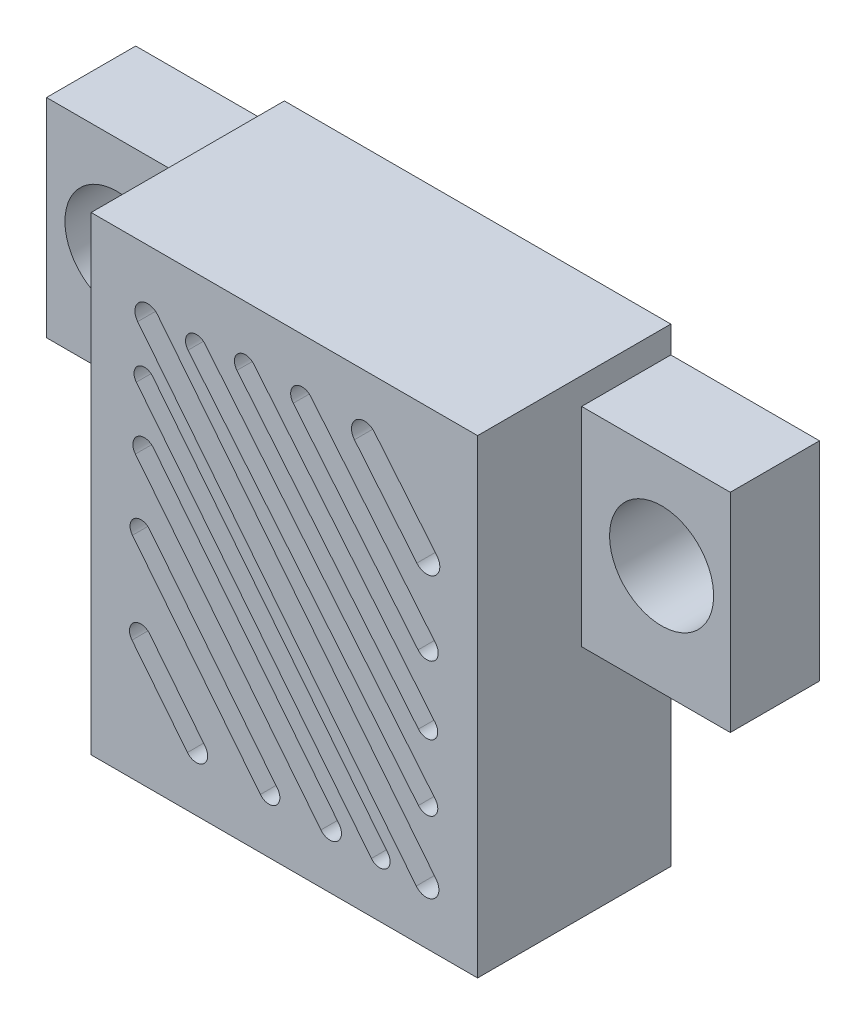
from build123d import *

# Parameters (mm, degrees)
SKETCH1_W           = 13
SKETCH1_H           = 15.8
BOSS_EXTRUDE1_DEPTH = 6.5
SHELL1_T            = -1
CUT_EXTRUDE2_DEPTH  = 2.5
SKETCH3_W           = 5
SKETCH3_H           = 7
BOSS_EXTRUDE2_DEPTH = 3
SKETCH4_R           = 1.75
CUT_EXTRUDE3_DEPTH  = 5


with BuildPart() as part:
    # Sketch1 → Boss-Extrude1 (new body)
    with BuildSketch(Plane.XY):
        Rectangle(SKETCH1_W, SKETCH1_H)
    extrude(amount=BOSS_EXTRUDE1_DEPTH)

    # Shell1
    shell1_openings = [part.faces().sort_by_distance(p)[0] for p in [
        (0, 0, 0),
    ]]
    offset(amount=SHELL1_T, openings=shell1_openings, kind=Kind.INTERSECTION)

    # Sketch2 → Cut-Extrude2 (cut)
    with BuildSketch(Plane(origin=(0, 0, 5.5), x_dir=(-1, 0, 0), z_dir=(0, 0, -1))):
        with BuildLine():
            Line((-5.105072533, -5.71873747), (4.265069263, 6.036531329))
            ThreePointArc((4.265069263, 6.036531329), (4.865789922, 6.104354629), (4.933613222, 5.50363397))
            Line((4.933613222, 5.50363397), (-4.436528574, -6.251634828))
            ThreePointArc((-4.436528574, -6.251634828), (-5.037249233, -6.319458129), (-5.105072533, -5.71873747))
        make_face()
        with BuildLine():
            Line((-3.479803699, -5.763578957), (4.428264236, 4.157451726))
            ThreePointArc((4.428264236, 4.157451726), (4.923771659, 4.213396112), (4.979716045, 3.71788869))
            Line((4.979716045, 3.71788869), (-2.92835189, -6.203141993))
            ThreePointArc((-2.92835189, -6.203141993), (-3.423859312, -6.259086379), (-3.479803699, -5.763578957))
        make_face()
        with BuildLine():
            Line((-1.836206221, -5.738869047), (4.404824726, 2.090787959))
            ThreePointArc((4.404824726, 2.090787959), (4.949248544, 2.152255164), (5.01071575, 1.607831346))
            Line((5.01071575, 1.607831346), (-1.230315197, -6.22182566))
            ThreePointArc((-1.230315197, -6.22182566), (-1.774739016, -6.283292866), (-1.836206221, -5.738869047))
        make_face()
        with BuildLine():
            Line((0.230638955, -5.747393414), (4.533785605, -0.348900345))
            ThreePointArc((4.533785605, -0.348900345), (5.051093924, -0.290494567), (5.109499701, -0.807802886))
            Line((5.109499701, -0.807802886), (0.806353052, -6.206295955))
            ThreePointArc((0.806353052, -6.206295955), (0.289044733, -6.264701733), (0.230638955, -5.747393414))
        make_face()
        with BuildLine():
            Line((2.662525183, -5.734264805), (4.528368603, -3.393479423))
            ThreePointArc((4.528368603, -3.393479423), (5.065343895, -3.33285318), (5.125970138, -3.869828472))
            Line((5.125970138, -3.869828472), (3.260126717, -6.210613854))
            ThreePointArc((3.260126717, -6.210613854), (2.723151425, -6.271240097), (2.662525183, -5.734264805))
        make_face()
        with BuildLine():
            Line((-5.076600471, -3.401160753), (2.673836157, 5.986195062))
            ThreePointArc((2.673836157, 5.986195062), (3.1909607, 6.035588301), (3.24035394, 5.518463758))
            Line((3.24035394, 5.518463758), (-4.510082688, -3.868892057))
            ThreePointArc((-4.510082688, -3.868892057), (-5.027207231, -3.918285297), (-5.076600471, -3.401160753))
        make_face()
        with BuildLine():
            Line((-5.075895555, -1.176345618), (1.030282687, 6.219478717))
            ThreePointArc((1.030282687, 6.219478717), (1.546120318, 6.268749037), (1.595390638, 5.752911406))
            Line((1.595390638, 5.752911406), (-4.510787604, -1.642912929))
            ThreePointArc((-4.510787604, -1.642912929), (-5.026625235, -1.692183249), (-5.075895555, -1.176345618))
        make_face()
        with BuildLine():
            Line((-5.088414127, 1.144510192), (-0.889859337, 6.229814365))
            ThreePointArc((-0.889859337, 6.229814365), (-0.351167486, 6.281267609), (-0.299714242, 5.742575759))
            Line((-0.299714242, 5.742575759), (-4.498269031, 0.657271586))
            ThreePointArc((-4.498269031, 0.657271586), (-5.036960882, 0.605818341), (-5.088414127, 1.144510192))
        make_face()
        with BuildLine():
            Line((-5.129445403, 3.72103873), (-3.030168008, 6.263690816))
            ThreePointArc((-3.030168008, 6.263690816), (-2.416568429, 6.322298886), (-2.35796036, 5.708699307))
            Line((-2.35796036, 5.708699307), (-4.457237755, 3.166047221))
            ThreePointArc((-4.457237755, 3.166047221), (-5.070837334, 3.107439152), (-5.129445403, 3.72103873))
        make_face()
    extrude(amount=-CUT_EXTRUDE2_DEPTH, mode=Mode.SUBTRACT)

    # Sketch3 → Boss-Extrude2 (add)
    with BuildSketch(Plane(origin=(0, 0, 0), x_dir=(-1, 0, 0), z_dir=(0, 0, -1))):
        with Locations((9, 3.5)):
            Rectangle(SKETCH3_W, SKETCH3_H)
        with Locations((-9, 3.5)):
            Rectangle(SKETCH3_W, SKETCH3_H)
    extrude(amount=-BOSS_EXTRUDE2_DEPTH)

    # Sketch4 → Cut-Extrude3 (cut)
    with BuildSketch(Plane(origin=(0, 0, 0), x_dir=(-1, 0, 0), z_dir=(0, 0, -1))):
        with Locations((-9.18918569, 3.702089239)):
            Circle(SKETCH4_R)
        with Locations((9.130886442, 3.702089239)):
            Circle(SKETCH4_R)
    extrude(amount=-CUT_EXTRUDE3_DEPTH, mode=Mode.SUBTRACT)


solid = part.part
